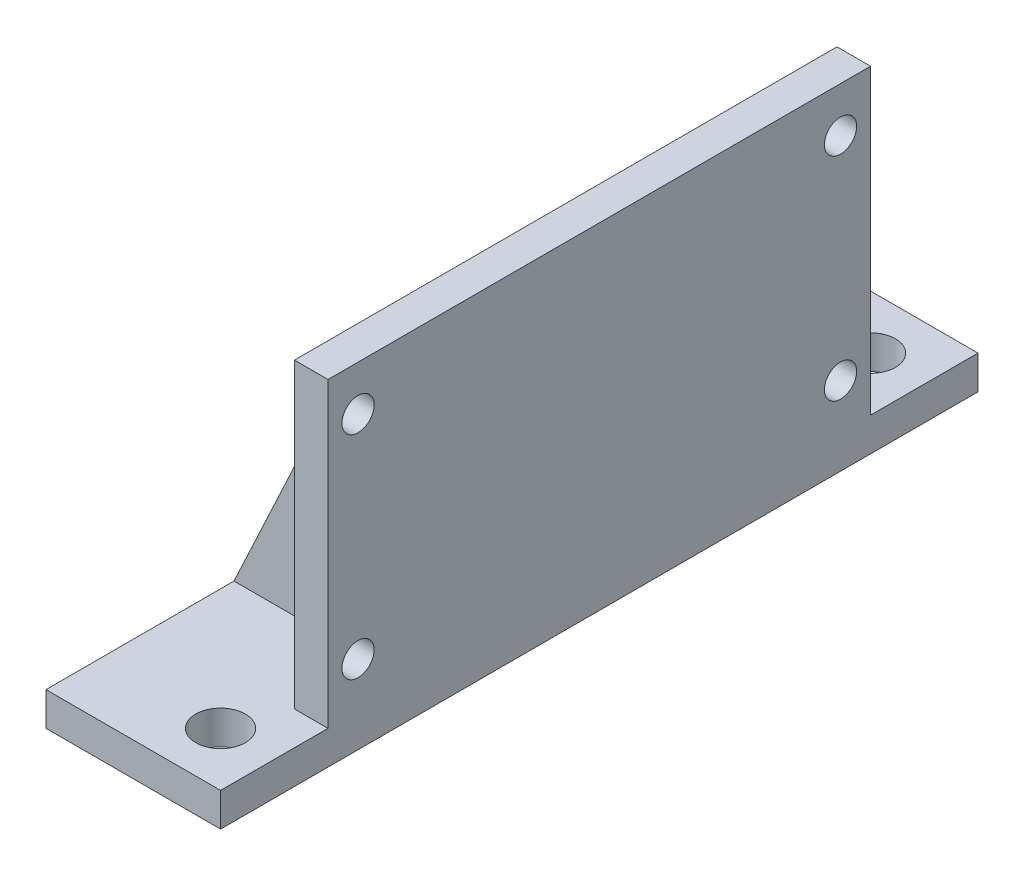
from build123d import *

# Parameters (mm, degrees)
SKETCH1_W           = 16.51
SKETCH1_H           = 71.632288028
SKETCH1_R           = 2.3495
BOSS_EXTRUDE1_DEPTH = 3.175
SKETCH2_W           = 51.312288028
SKETCH2_H           = 28.575
SKETCH2_R           = 1.524
BOSS_EXTRUDE2_DEPTH = 3.175
BOSS_EXTRUDE3_DEPTH = 2.54


with BuildPart() as part:
    # Sketch1 → Boss-Extrude1 (new body)
    with BuildSketch(Plane(origin=(0, 0, 0), x_dir=(1, 0, 0), z_dir=(0, 1, 0))):
        with Locations((-3.175, 30.736144014)):
            Rectangle(SKETCH1_W, SKETCH1_H)
        with Locations(Location((0, 61.472288028, 0), (0, 0, 270))):
            Circle(SKETCH1_R, mode=Mode.SUBTRACT)
        with Locations(Location((0, 0, 0), (0, 0, 270))):
            Circle(SKETCH1_R, mode=Mode.SUBTRACT)
    extrude(amount=BOSS_EXTRUDE1_DEPTH)

    # Sketch2 → Boss-Extrude2 (add)
    with BuildSketch(Plane(origin=(5.08, 0, 0), x_dir=(0, 0, -1), z_dir=(1, 0, 0))):
        with Locations((30.736144014, 17.4625)):
            Rectangle(SKETCH2_W, SKETCH2_H)
        with Locations((7.921390431, 7.4295)):
            Circle(SKETCH2_R, mode=Mode.SUBTRACT)
        with Locations((53.550897597, 7.4295)):
            Circle(SKETCH2_R, mode=Mode.SUBTRACT)
        with Locations((7.921390431, 27.4955)):
            Circle(SKETCH2_R, mode=Mode.SUBTRACT)
        with Locations((53.550897597, 27.4955)):
            Circle(SKETCH2_R, mode=Mode.SUBTRACT)
    extrude(amount=-BOSS_EXTRUDE2_DEPTH)

    # Sketch3 → Boss-Extrude3 (add)
    with BuildSketch(Plane(origin=(0, 0, -48.772288028), x_dir=(-1, 0, 0), z_dir=(0, 0, -1))):
        Polygon((-1.905, 31.75), (-1.905, 3.175), (11.43, 3.175), align=None)
    boss_extrude3 = extrude(amount=-BOSS_EXTRUDE3_DEPTH)

    # Mirror1: Boss-Extrude3 across plane
    add(boss_extrude3.mirror(Plane.XY.offset(-30.736144014)))


solid = part.part
